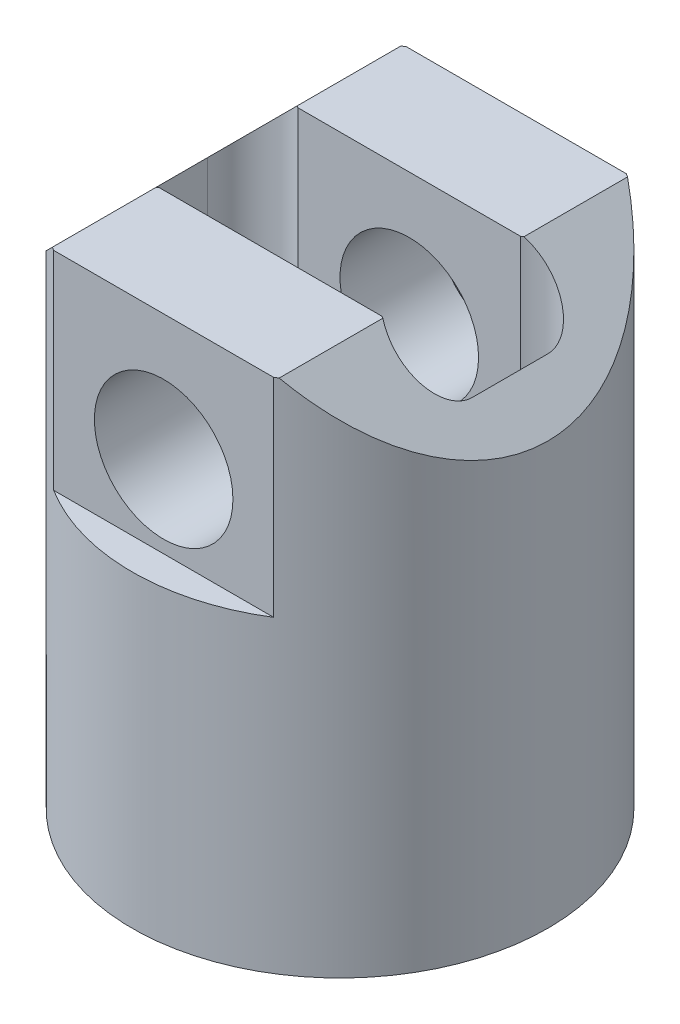
from build123d import *

# Parameters (mm, degrees)
HOLE_WIZARD_M561_D           = 54
HOLE_WIZARD_M561_DEPTH       = 30
HOLE_WIZARD_M561_CSINK_D     = 58
HOLE_WIZARD_M561_CSINK_ANGLE = 90
CUT_EXTRUDE_START            = 28
SKETCH_4_W                   = 66
SKETCH_4_H                   = 33
CUT_EXTRUDE_1_DEPTH          = 67.350410704
CUT_EXTRUDE_START_2          = -28
SKETCH_4_2_W                 = 66
SKETCH_4_2_H                 = 33
CUT_EXTRUDE_2_DEPTH          = 67.350410704
SKETCH_5_R                   = 11
CUT_EXTRUDE_3_DEPTH          = 108.396461767
CUT_EXTRUDE_5_DEPTH          = 50
CUT_EXTRUDE_6_DEPTH          = 95.350410791
CUT_EXTRUDE_6_DEPTH_BACK     = 95.350410791
CHAMFER_1_SIZE               = 1.6
CUT_EXTRUDE_8_DEPTH          = 95.350410791


with BuildPart() as part:
    # Эскиз1 → Повернуть1 (revolve)
    with BuildSketch(Plane.XY):
        with BuildLine():
            Line((-33, 0), (-33, 82))
            Line((-33, 82), (0, 82))
            Line((0, 82), (0, 40))
            Line((0, 40), (-22.5, 40))
            Line((-22.5, 40), (-22.5, 37))
            Line((-22.5, 37), (-27.25, 37))
            ThreePointArc((-27.25, 37), (-27.957106781, 36.707106781), (-28.25, 36))
            Line((-28.25, 36), (-28.25, 29.414213562))
            ThreePointArc((-28.25, 29.414213562), (-28.173879533, 29.03153013), (-27.957106781, 28.707106781))
            Line((-27.957106781, 28.707106781), (0, 0.75))
            Line((0, 0.75), (0, 0))
            Line((0, 0), (-33, 0))
        make_face()
    revolve(axis=Axis((0, 0, 0), (0, 1, 0)))

    # Отверстие обработанное метчиком M561
    with Locations(Plane(origin=(0, 0, 0), x_dir=(-1, 0, 0), z_dir=(0, -1, 0))):
        with Locations((0, 0)):
            CounterSinkHole(HOLE_WIZARD_M561_D / 2, HOLE_WIZARD_M561_CSINK_D / 2, depth=HOLE_WIZARD_M561_DEPTH, counter_sink_angle=HOLE_WIZARD_M561_CSINK_ANGLE)

    # Эскиз4 → Вырез-Вытянуть1 (cut, through all)
    with BuildSketch(Plane.XY.offset(CUT_EXTRUDE_START)):
        with Locations((0, 65.5)):
            Rectangle(SKETCH_4_W, SKETCH_4_H)
    extrude(amount=CUT_EXTRUDE_1_DEPTH, mode=Mode.SUBTRACT)

    # Эскиз4<2> → Вырез-Вытянуть2 (cut, through all)
    with BuildSketch(Plane.XY.offset(CUT_EXTRUDE_START_2)):
        with Locations((0, 65.5)):
            Rectangle(SKETCH_4_2_W, SKETCH_4_2_H)
    extrude(amount=-CUT_EXTRUDE_2_DEPTH, mode=Mode.SUBTRACT)

    # Эскиз5 → Вырез-Вытянуть3 (cut, through all)
    with BuildSketch(Plane.XY.offset(28)):
        with Locations((0, 62)):
            Circle(SKETCH_5_R)
    extrude(amount=-CUT_EXTRUDE_3_DEPTH, mode=Mode.SUBTRACT)

    # Эскиз6 → Вырез-Вытянуть5 (cut)
    with BuildSketch(Plane(origin=(0, 82, 0), x_dir=(1, 0, 0), z_dir=(0, 1, 0))):
        with BuildLine():
            Line((17.68337521, -11), (-17.68337521, -11))
            ThreePointArc((-17.68337521, -11), (-23.837274331, -11.286764074), (-27, -6))
            Line((-27, -6), (-27, 6))
            ThreePointArc((-27, 6), (-23.837274331, 11.286764074), (-17.68337521, 11))
            Line((-17.68337521, 11), (17.68337521, 11))
            ThreePointArc((17.68337521, 11), (23.837274331, 11.286764074), (27, 6))
            Line((27, 6), (27, -6))
            ThreePointArc((27, -6), (23.837274331, -11.286764074), (17.68337521, -11))
        make_face()
    extrude(amount=-CUT_EXTRUDE_5_DEPTH, mode=Mode.SUBTRACT)

    # Эскиз7 → Вырез-Вытянуть6 (cut, two sides: drawn at the far end of the back side and taken through both)
    with BuildSketch(Plane.XY.offset(-CUT_EXTRUDE_6_DEPTH_BACK)):
        Polygon((-33, 82), (-18, 82), (-33, 67), align=None)
        Polygon((33, 67), (33, 82), (18, 82), align=None)
    extrude(amount=CUT_EXTRUDE_6_DEPTH + CUT_EXTRUDE_6_DEPTH_BACK, mode=Mode.SUBTRACT)

    # Фаска1
    chamfer_1_edges = [part.edges().sort_by_distance(p)[0] for p in [
        (-11, 62, -28),
    ]]
    chamfer(chamfer_1_edges, length=CHAMFER_1_SIZE)

    # Эскиз10 → Вырез-Вытянуть8 (cut, through all)
    with BuildSketch(Plane.XY):
        with BuildLine():
            Line((-5.5, 0), (5.5, 0))
            Line((5.5, 0), (5.5, 10.5))
            ThreePointArc((5.5, 10.5), (0, 16), (-5.5, 10.5))
            Line((-5.5, 10.5), (-5.5, 0))
        make_face()
    extrude(amount=-CUT_EXTRUDE_8_DEPTH, mode=Mode.SUBTRACT)


solid = part.part
